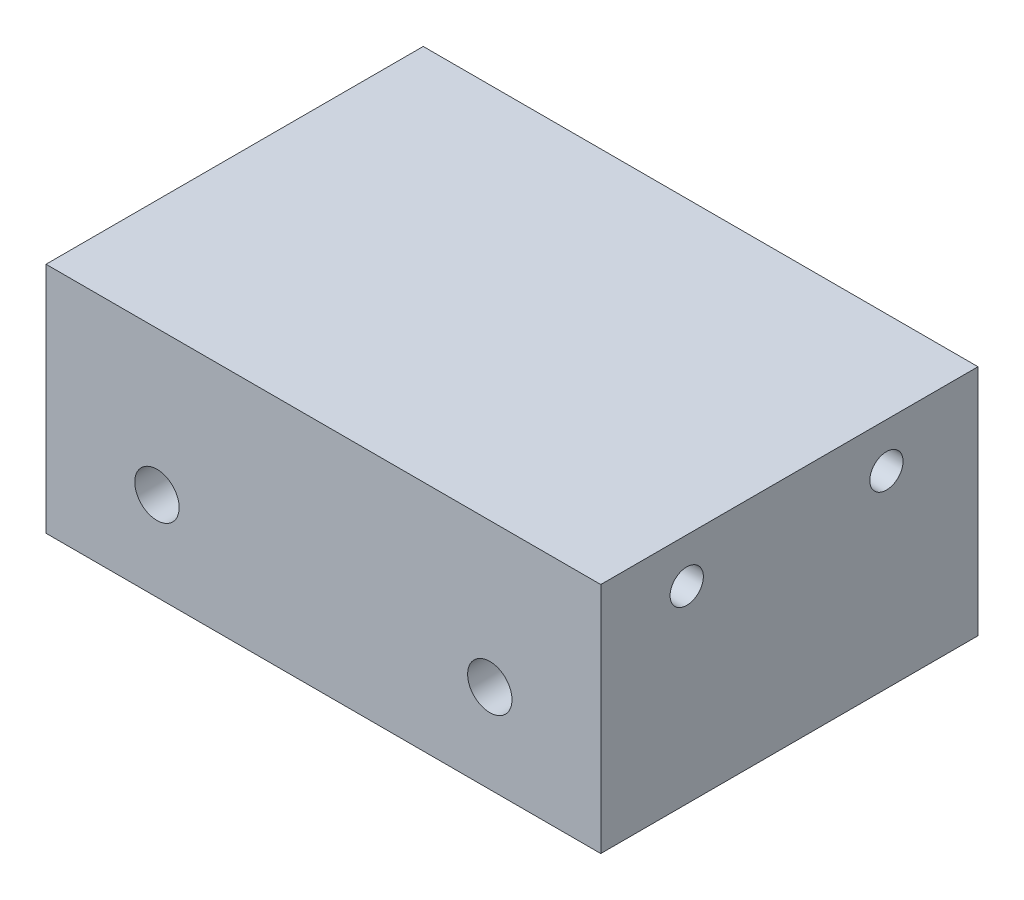
from build123d import *

# Parameters (mm, degrees)
SKETCH_1_W          = 50
SKETCH_1_H          = 21
EXTRUDE_1_DEPTH     = 34
SKETCH_2_R          = 2
CUT_EXTRUDE_1_DEPTH = 49.548944376
SKETCH_3_R          = 1.5
CUT_EXTRUDE_2_DEPTH = 66.053823869


with BuildPart() as part:
    # 草图1 → 凸台-拉伸1 (new body)
    with BuildSketch(Plane.XY):
        with Locations((0, -13.5)):
            Rectangle(SKETCH_1_W, SKETCH_1_H)
    extrude(amount=EXTRUDE_1_DEPTH)

    # 草图2 → 切除-拉伸1 (cut, through all)
    with BuildSketch(Plane(origin=(0, 0, 0), x_dir=(-1, 0, 0), z_dir=(0, 0, -1))):
        with Locations((-15, -16)):
            Circle(SKETCH_2_R)
        with Locations((15, -16)):
            Circle(SKETCH_2_R)
    extrude(amount=-CUT_EXTRUDE_1_DEPTH, mode=Mode.SUBTRACT)

    # 草图3 → 切除-拉伸2 (cut, through all)
    with BuildSketch(Plane.ZY.offset(25)):
        with Locations(Location((8.252553912, -7, 0), (0, 0, 270))):
            Circle(SKETCH_3_R)
        with Locations(Location((26.252553912, -7, 0), (0, 0, 270))):
            Circle(SKETCH_3_R)
    extrude(amount=-CUT_EXTRUDE_2_DEPTH, mode=Mode.SUBTRACT)


solid = part.part
